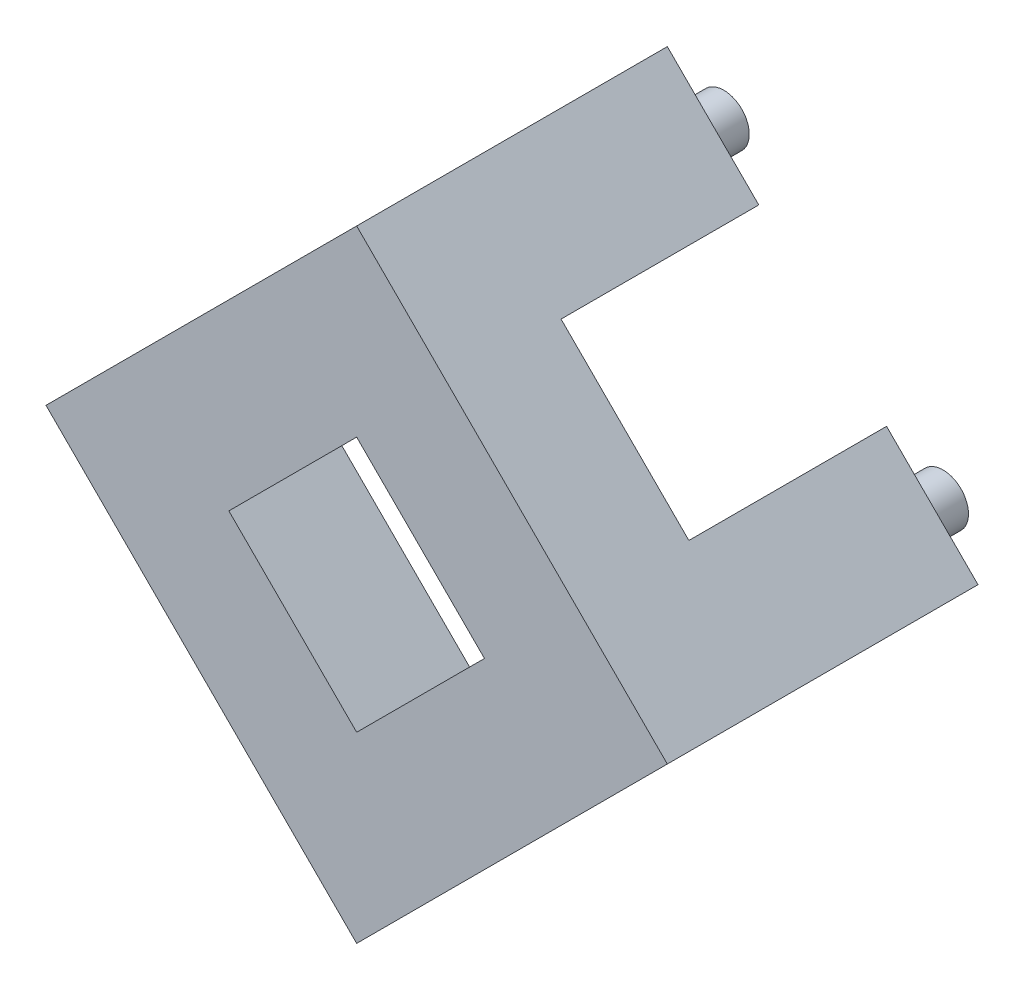
from build123d import *

# Parameters (mm, degrees)
BOSS_EXTRU_1_DEPTH        = 50
BOSS_EXTRU_1_DEPTH_BACK   = 5
BOSS_EXTRU_1_2_DEPTH      = 50
BOSS_EXTRU_1_2_DEPTH_BACK = 5
BOSS_EXTRU_1_3_DEPTH      = 50
BOSS_EXTRU_1_3_DEPTH_BACK = 5
BOSS_EXTRU_1_4_DEPTH      = 50
BOSS_EXTRU_1_4_DEPTH_BACK = 5
BOSS_EXTRU_2_DEPTH        = 20
ESQUISSE4_R               = 4.5
BOSS_EXTRU_3_DEPTH        = 10


with BuildPart() as part:
    # Esquisse1 → Boss.-Extru.1 (new, two sides: drawn at the far end of the back side and taken through both)
    with BuildSketch(Plane.XY.offset(15).offset(-BOSS_EXTRU_1_DEPTH_BACK)):
        Polygon((0, 55), (-16.186291501, 38.813708499), (0, 22.627416998), (16.186291501, 38.813708499), align=None)
    extrude(amount=BOSS_EXTRU_1_DEPTH + BOSS_EXTRU_1_DEPTH_BACK)



with BuildPart() as body_2:
    # Esquisse1 → Boss.-Extru.1 2 (new, two sides: drawn at the far end of the back side and taken through both)
    with BuildSketch(Plane.XY.offset(15).offset(-BOSS_EXTRU_1_2_DEPTH_BACK)):
        Polygon((-38.813708499, 16.186291501), (-55, 0), (-38.813708499, -16.186291501), (-22.627416998, 0), align=None)
    extrude(amount=BOSS_EXTRU_1_2_DEPTH + BOSS_EXTRU_1_2_DEPTH_BACK)


with BuildPart() as body_3:
    # Esquisse1 → Boss.-Extru.1 3 (new, two sides: drawn at the far end of the back side and taken through both)
    with BuildSketch(Plane.XY.offset(15).offset(-BOSS_EXTRU_1_3_DEPTH_BACK)):
        Polygon((-16.186291501, -38.813708499), (0, -55), (16.186291501, -38.813708499), (0, -22.627416998), align=None)
    extrude(amount=BOSS_EXTRU_1_3_DEPTH + BOSS_EXTRU_1_3_DEPTH_BACK)


with BuildPart() as body_4:
    # Esquisse1 → Boss.-Extru.1 4 (new, two sides: drawn at the far end of the back side and taken through both)
    with BuildSketch(Plane.XY.offset(15).offset(-BOSS_EXTRU_1_4_DEPTH_BACK)):
        Polygon((38.813708499, -16.186291501), (55, 0), (38.813708499, 16.186291501), (22.627416998, 0), align=None)
    extrude(amount=BOSS_EXTRU_1_4_DEPTH + BOSS_EXTRU_1_4_DEPTH_BACK)


with BuildPart() as part_1:
    add(part.part)

    add(body_2.part)  # Boss.-Extru.2 merges body 2

    add(body_3.part)  # Boss.-Extru.2 merges body 3

    add(body_4.part)  # Boss.-Extru.2 merges body 4
    # Esquisse3 → Boss.-Extru.2 (add)
    with BuildSketch(Plane.XY.offset(65)):
        Polygon((22.627416998, 0), (0, 22.627416998), (16.186291501, 38.813708499), (38.813708499, 16.186291501), align=None)
        Polygon((-38.813708499, 16.186291501), (-16.186291501, 38.813708499), (0, 22.627416998), (-22.627416998, 0), align=None)
        Polygon((38.813708499, -16.186291501), (16.186291501, -38.813708499), (0, -22.627416998), (22.627416998, 0), align=None)
        Polygon((-38.813708499, -16.186291501), (-22.627416998, 0), (0, -22.627416998), (-16.186291501, -38.813708499), align=None)
    extrude(amount=-BOSS_EXTRU_2_DEPTH)

    # Esquisse4 → Boss.-Extru.3 (add)
    with BuildSketch(Plane(origin=(0, 0, 10), x_dir=(-1, 0, 0), z_dir=(0, 0, -1))):
        with Locations(Location((0, -38.813708499, 0), (0, 0, 180))):
            Circle(ESQUISSE4_R)
        with Locations(Location((-38.813708499, 0, 0), (0, 0, 180))):
            Circle(ESQUISSE4_R)
        with Locations(Location((0, 38.813708499, 0), (0, 0, 180))):
            Circle(ESQUISSE4_R)
        with Locations(Location((38.813708499, 0, 0), (0, 0, 180))):
            Circle(ESQUISSE4_R)
    extrude(amount=BOSS_EXTRU_3_DEPTH)


solid = part_1.part
